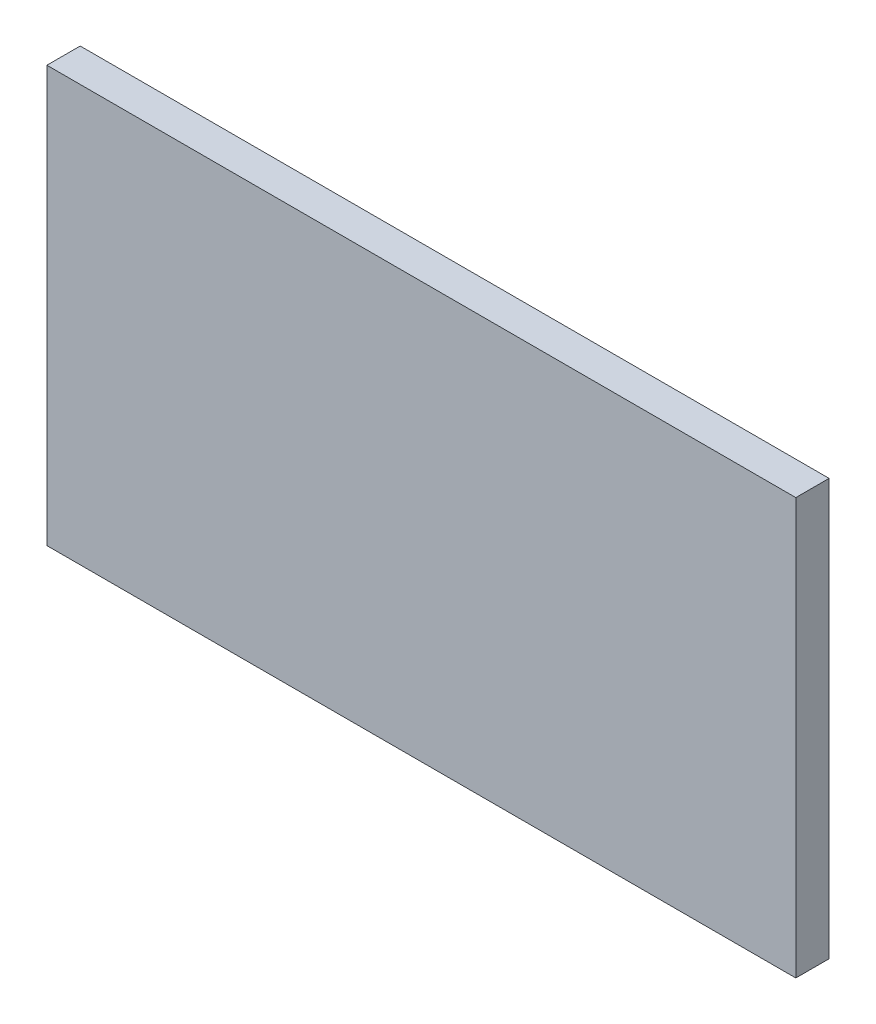
from build123d import *

# Parameters (mm, degrees)
SKETCH_1_W      = 180
SKETCH_1_H      = 100
EXTRUDE_1_DEPTH = 8


with BuildPart() as part:
    # 草图1 → 凸台-拉伸1 (new body)
    with BuildSketch(Plane.XY):
        with Locations((23.552544453, -16.366914046)):
            Rectangle(SKETCH_1_W, SKETCH_1_H)
    extrude(amount=EXTRUDE_1_DEPTH)


solid = part.part
